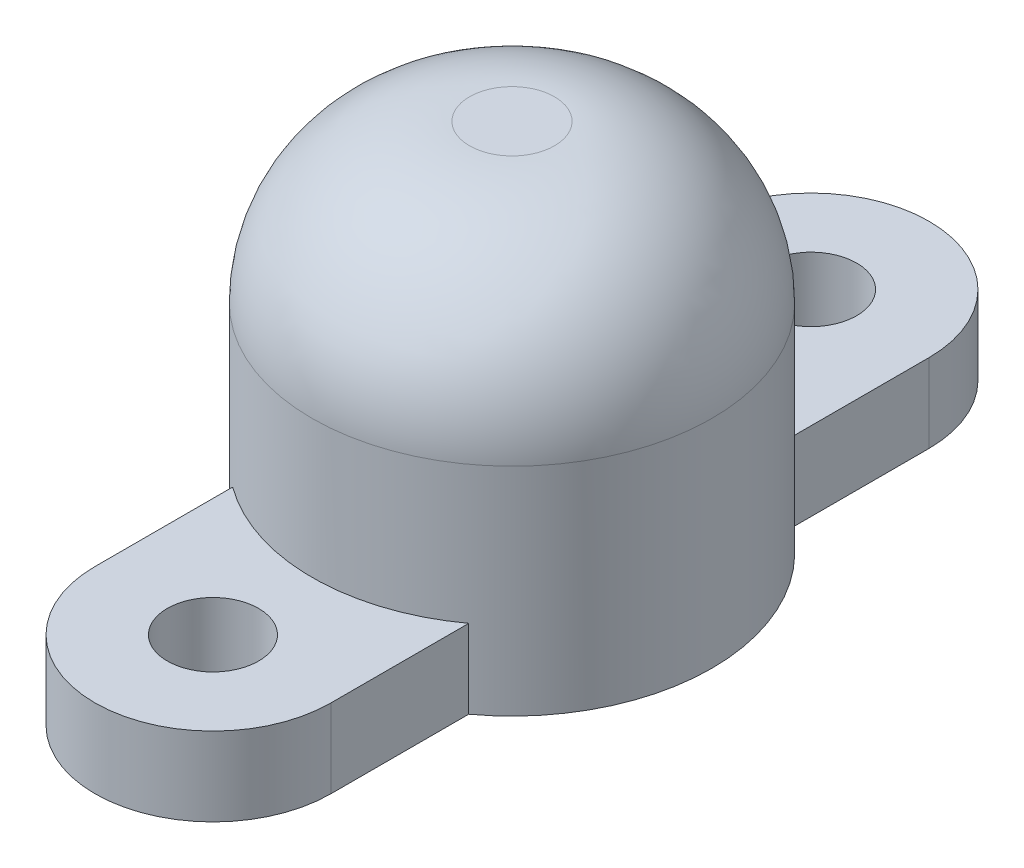
from build123d import *

# Parameters (mm, degrees)
SKETCH1_R           = 12.7
BOSS_EXTRUDE1_DEPTH = 23.75
FILLET1_R           = 10
SKETCH2_R           = 2.9
BOSS_EXTRUDE2_DEPTH = 5


with BuildPart() as part:
    # Sketch1 → Boss-Extrude1 (new body)
    with BuildSketch(Plane(origin=(0, 0, 0), x_dir=(1, 0, 0), z_dir=(0, 1, 0))):
        with Locations(Location((0, 0, 0), (0, 0, 270))):
            Circle(SKETCH1_R)
    extrude(amount=BOSS_EXTRUDE1_DEPTH)

    # Fillet1
    fillet1_edges = [part.edges().sort_by_distance(p)[0] for p in [
        (0, 23.75, -12.7),
    ]]
    fillet(fillet1_edges, radius=FILLET1_R)

    # Sketch2 → Boss-Extrude2 (add)
    with BuildSketch(Plane.XZ):
        with BuildLine():
            Line((7.5, 19), (7.5, -19))
            ThreePointArc((7.5, -19), (0, -26.5), (-7.5, -19))
            Line((-7.5, -19), (-7.5, 19))
            ThreePointArc((-7.5, 19), (0, 26.5), (7.5, 19))
        make_face()
        with Locations(Location((0, 19, 0), (0, 0, 270))):
            Circle(SKETCH2_R, mode=Mode.SUBTRACT)
        with Locations(Location((0, -19, 0), (0, 0, 270))):
            Circle(SKETCH2_R, mode=Mode.SUBTRACT)
    extrude(amount=-BOSS_EXTRUDE2_DEPTH)


solid = part.part
